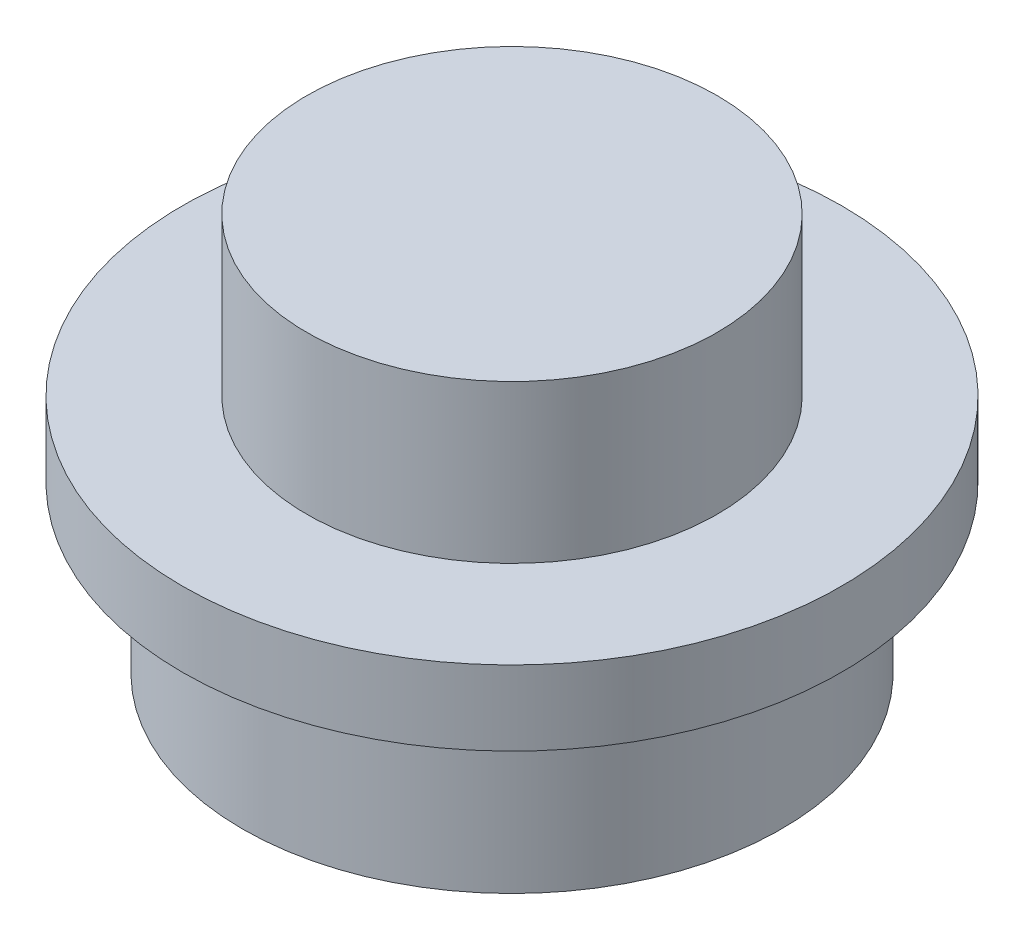
from build123d import *

# Parameters (mm, degrees)
SKETCH1_R           = 3.25
SKETCH1_R_2         = 2.475
BOSS_EXTRUDE1_DEPTH = 2
SKETCH2_R           = 3.975
BOSS_EXTRUDE2_DEPTH = 0.9
SKETCH3_R           = 2.475
BOSS_EXTRUDE3_DEPTH = 1.9


with BuildPart() as part:
    # Sketch1 → Boss-Extrude1 (new body)
    with BuildSketch(Plane(origin=(0, 0, 0), x_dir=(1, 0, 0), z_dir=(0, 1, 0))):
        with Locations(Location((-7.991653638, -13.40535449, 0), (0, 0, 270))):
            Circle(SKETCH1_R)
        with Locations(Location((-7.991653638, -13.40535449, 0), (0, 0, 270))):
            Circle(SKETCH1_R_2, mode=Mode.SUBTRACT)
    extrude(amount=BOSS_EXTRUDE1_DEPTH)

    # Sketch2 → Boss-Extrude2 (add)
    with BuildSketch(Plane(origin=(0, 2, 0), x_dir=(1, 0, 0), z_dir=(0, 1, 0))):
        with Locations(Location((-7.991653638, -13.40535449, 0), (0, 0, 270))):
            Circle(SKETCH2_R)
    extrude(amount=BOSS_EXTRUDE2_DEPTH)

    # Sketch3 → Boss-Extrude3 (add)
    with BuildSketch(Plane(origin=(0, 2.9, 0), x_dir=(-1, 0, 0), z_dir=(0, 1, 0))):
        with Locations(Location((7.991653638, 13.40535449, 0), (0, 0, 90))):
            Circle(SKETCH3_R)
    extrude(amount=BOSS_EXTRUDE3_DEPTH)


solid = part.part
